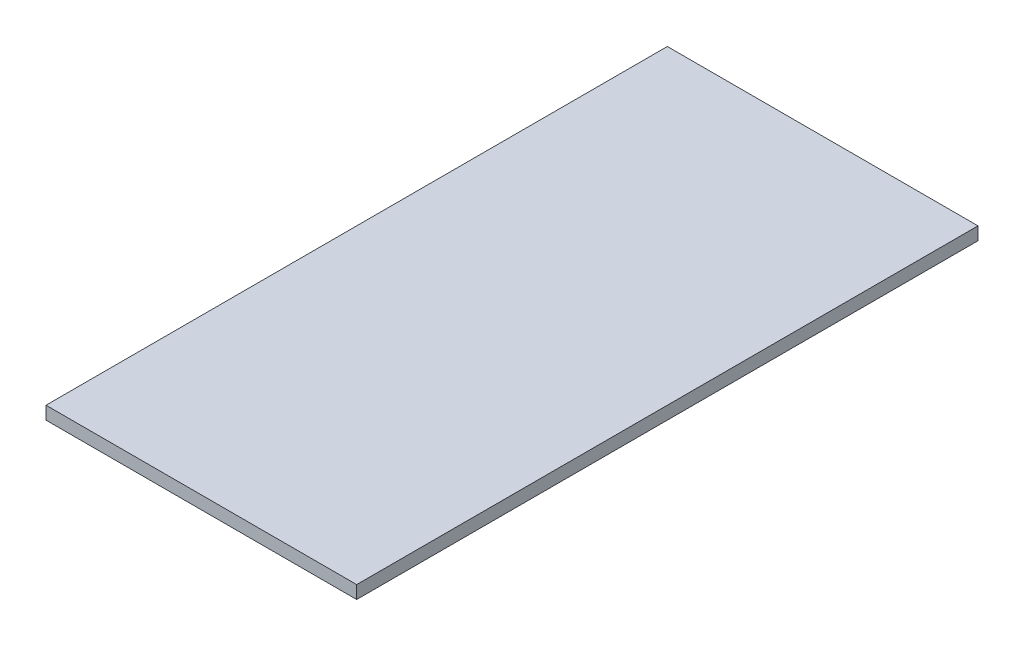
from build123d import *

# Parameters (mm, degrees)
SKETCH1_W           = 76.2
SKETCH1_H           = 152.4
BOSS_EXTRUDE1_DEPTH = 3.175


with BuildPart() as part:
    # Sketch1 → Boss-Extrude1 (new body)
    with BuildSketch(Plane(origin=(0, 0, 0), x_dir=(1, 0, 0), z_dir=(0, 1, 0))):
        Rectangle(SKETCH1_W, SKETCH1_H)
    extrude(amount=BOSS_EXTRUDE1_DEPTH)


solid = part.part
